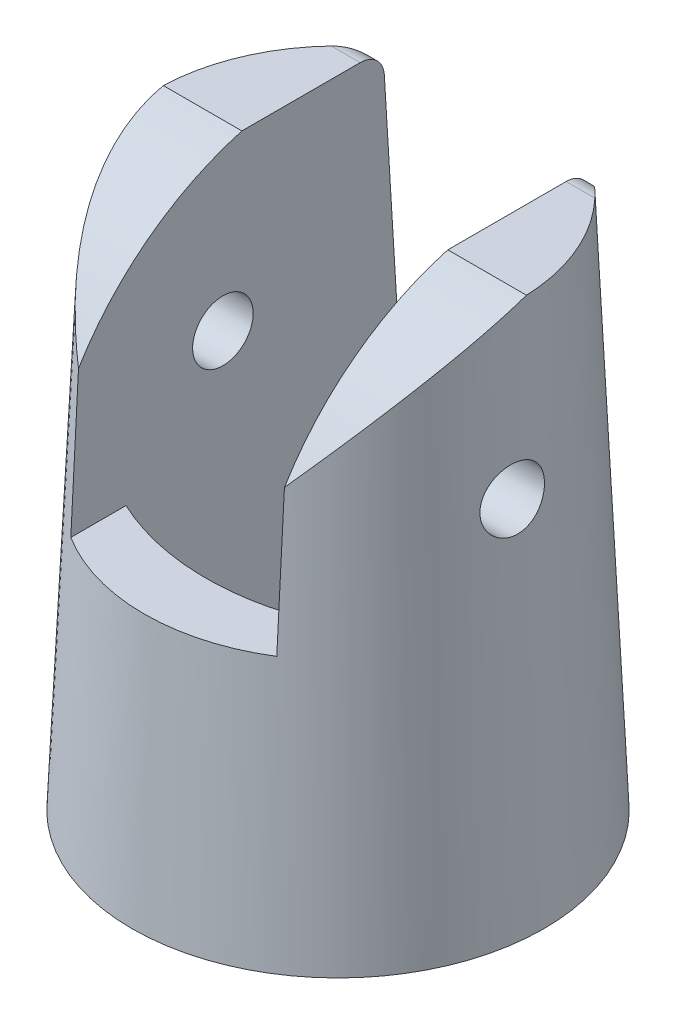
from build123d import *

# Parameters (mm, degrees)
SKETCH2_R               = 7.5
SKETCH3_R               = 8.5
CUT_EXTRUDE1_DEPTH      = 10
CUT_EXTRUDE1_DEPTH_BACK = 10
SKETCH9_W               = 8.5
SKETCH9_H               = 24.609106297
CUT_EXTRUDE2_DEPTH      = 10
CUT_EXTRUDE2_DEPTH_BACK = 10
CUT_EXTRUDE3_DEPTH      = 14
FILLET1_R               = 1
SKETCH12_R              = 1.25
CUT_EXTRUDE4_DEPTH      = 30


with BuildPart() as part:
    # Sketch2 → Loft1 section 0
    with BuildSketch(Plane(origin=(0, 22, 0), x_dir=(1, 0, 0), z_dir=(0, 1, 0))):
        Circle(SKETCH2_R)
    # Sketch3 → Loft1 section 1
    with BuildSketch(Plane(origin=(0, 0, 0), x_dir=(1, 0, 0), z_dir=(0, 1, 0))):
        Circle(SKETCH3_R)
    loft()

    # Sketch9 → Cut-Extrude1 (cut, two sides: drawn at the far end of the back side and taken through both)
    with BuildSketch(Plane.XY.offset(-CUT_EXTRUDE1_DEPTH_BACK)):
        with Locations((0, 23.304553149)):
            Rectangle(SKETCH9_W, SKETCH9_H)
    extrude(amount=CUT_EXTRUDE1_DEPTH + CUT_EXTRUDE1_DEPTH_BACK, mode=Mode.SUBTRACT)

    # Sketch10 → Cut-Extrude2 (cut, two sides: drawn at the far end of the back side and taken through both)
    with BuildSketch(Plane(origin=(0, 0, 0), x_dir=(0, 0, -1), z_dir=(1, 0, 0)).offset(-CUT_EXTRUDE2_DEPTH_BACK)):
        with BuildLine():
            ThreePointArc((1.551397817, 22.278129211), (-3.230375863, 20.336914385), (-6.681717999, 16.5))
            Line((-6.681717999, 16.5), (-6.777720856, 11))
            Line((-6.777720856, 11), (-14.541953313, 11))
            Line((-14.541953313, 11), (-14.541953313, 25.761445422))
            Line((-14.541953313, 25.761445422), (14.965624753, 25.761445422))
            Line((14.965624753, 25.761445422), (14.965624753, 11))
            Line((14.965624753, 11), (6.777720856, 11))
            Line((6.777720856, 11), (6.043769414, 23))
            Line((6.043769414, 23), (1.551397817, 22.278129211))
        make_face()
    extrude(amount=CUT_EXTRUDE2_DEPTH + CUT_EXTRUDE2_DEPTH_BACK, mode=Mode.SUBTRACT)

    # Sketch11 → Cut-Extrude3 (cut)
    with BuildSketch(Plane(origin=(0, 0, 0), x_dir=(-1, 0, 0), z_dir=(0, -1, 0))):
        with BuildLine():
            Line((4.25, -4.5), (4.25, 4.5))
            ThreePointArc((4.25, 4.5), (0, 5.448066505), (-4.25, 4.5))
            Line((-4.25, 4.5), (-4.25, -4.5))
            ThreePointArc((-4.25, -4.5), (0, -5.448066505), (4.25, -4.5))
        make_face()
    extrude(amount=-CUT_EXTRUDE3_DEPTH, mode=Mode.SUBTRACT)

    # Fillet1
    fillet1_edges = [part.edges().sort_by_distance(p)[0] for p in [
        (4.303290893, 22, -6.104932034),
        (-4.303290893, 22, -6.104932034),
    ]]
    fillet(fillet1_edges, radius=FILLET1_R)

    # Sketch12 → Cut-Extrude4 (cut, symmetric)
    with BuildSketch(Plane(origin=(0, 0, 0), x_dir=(0, 0, -1), z_dir=(1, 0, 0))):
        with Locations(Location((-0.5, 15.25, 0), (0, 0, 314.746693022))):
            Circle(SKETCH12_R)
    extrude(amount=CUT_EXTRUDE4_DEPTH, both=True, mode=Mode.SUBTRACT)


solid = part.part
